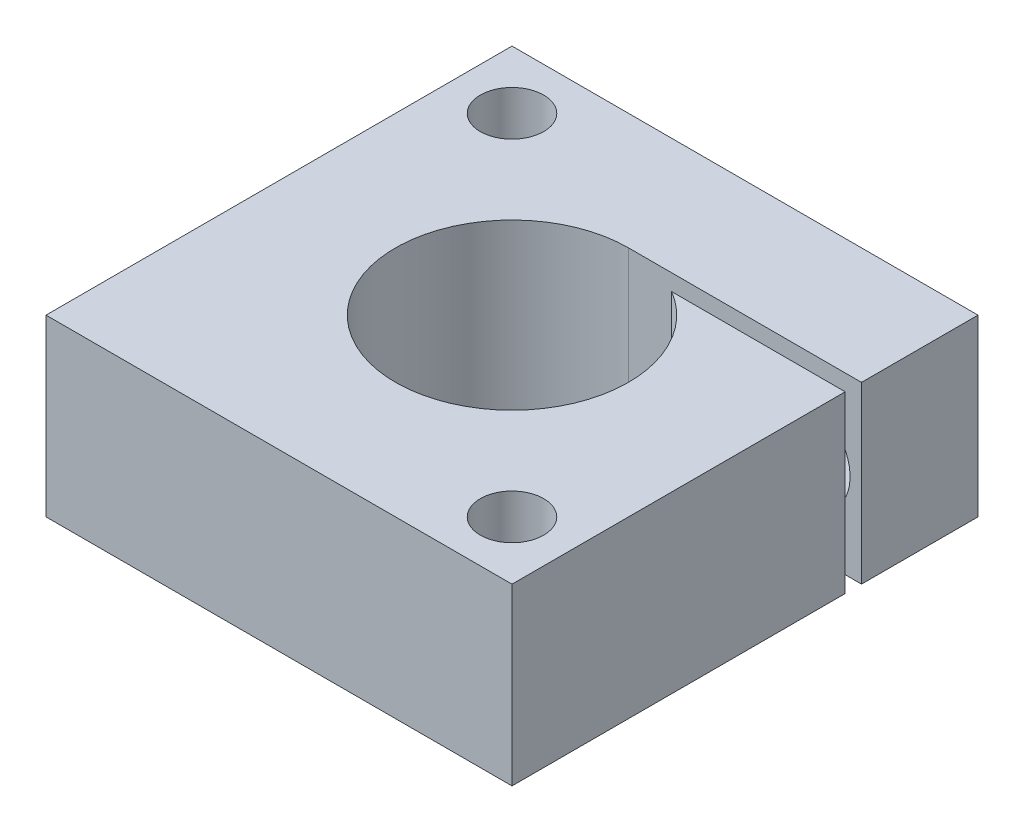
from build123d import *

# Parameters (mm, degrees)
BOSS_EXTRUDE1_DEPTH        = 9.525
F_8_32_TAPPED_HOLE1_D      = 3.4544
F_10_CLEARANCE_HOLE1_D     = 5.1054
F_10_CLEARANCE_HOLE1_DEPTH = 6.35


with BuildPart() as part:
    # Sketch1 → Boss-Extrude1 (new body)
    with BuildSketch(Plane(origin=(0, 0, 0), x_dir=(1, 0, 0), z_dir=(0, 1, 0))):
        with BuildLine():
            Line((1.500621967, 8.481252019), (1.500621967, -9.679747981))
            Line((1.500621967, -9.679747981), (-23.899378033, -9.679747981))
            Line((-23.899378033, -9.679747981), (-23.899378033, 15.720252019))
            Line((-23.899378033, 15.720252019), (1.500621967, 15.720252019))
            Line((1.500621967, 15.720252019), (1.500621967, 9.370252019))
            Line((1.500621967, 9.370252019), (-11.199378033, 9.370252019))
            ThreePointArc((-11.199378033, 9.370252019), (-12.879430115, -3.103466214), (-7.959010924, 8.481252019))
            Line((-7.959010924, 8.481252019), (1.500621967, 8.481252019))
        make_face()
    extrude(amount=BOSS_EXTRUDE1_DEPTH)

    # #8-32 Tapped Hole1 (through all)
    with Locations(Plane(origin=(0, 9.525, 0), x_dir=(1, 0, 0), z_dir=(0, 1, 0))):
        with Locations((-20.724378033, 12.545252019), (-1.674378033, -6.504747981)):
            Hole(F_8_32_TAPPED_HOLE1_D / 2)

    # Sketch4 → #10-24 Tapped Hole1 (revolve, cut)
    with BuildSketch(Plane(origin=(-1.674378033, 4.7625, -8.481252019), x_dir=(0, 1, 0), z_dir=(1, 0, 0))):
        Polygon((0, 0), (0, 12.316824014), (1.89865, 11.176), (1.89865, 0), align=None)
    revolve(axis=Axis((-1.674378033, 4.7625, -14.831252019), (0, 0, 1)), mode=Mode.SUBTRACT)

    # #10 Clearance Hole1
    with Locations(Plane(origin=(0, 0, -15.720252019), x_dir=(-1, 0, 0), z_dir=(0, 0, -1))):
        with Locations((1.674378033, 4.7625)):
            Hole(F_10_CLEARANCE_HOLE1_D / 2, depth=F_10_CLEARANCE_HOLE1_DEPTH)


solid = part.part
